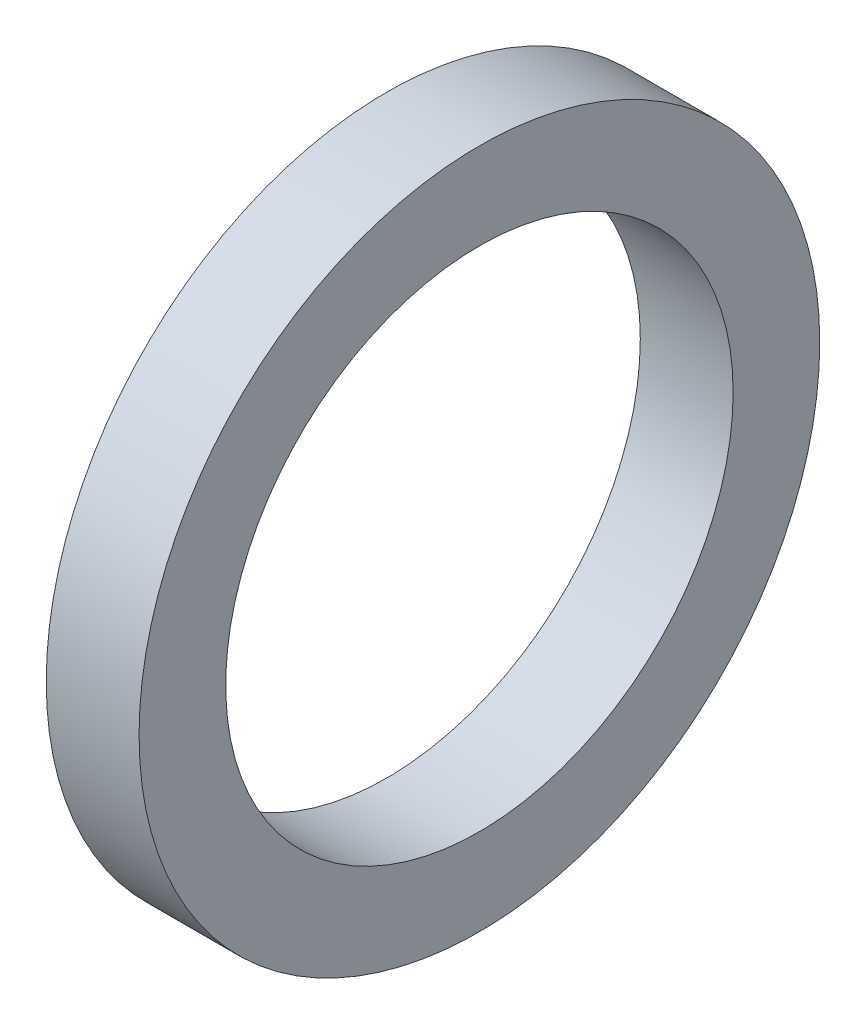
from build123d import *

# Parameters (mm, degrees)
SKETCH1_R           = 5.5
SKETCH1_R_2         = 4.1
BOSS_EXTRUDE1_DEPTH = 1.5


with BuildPart() as part:
    # Sketch1 → Boss-Extrude1 (new body)
    with BuildSketch(Plane(origin=(0, 0, 0), x_dir=(0, 0, -1), z_dir=(1, 0, 0))):
        Circle(SKETCH1_R)
        Circle(SKETCH1_R_2, mode=Mode.SUBTRACT)
    extrude(amount=BOSS_EXTRUDE1_DEPTH)


solid = part.part
